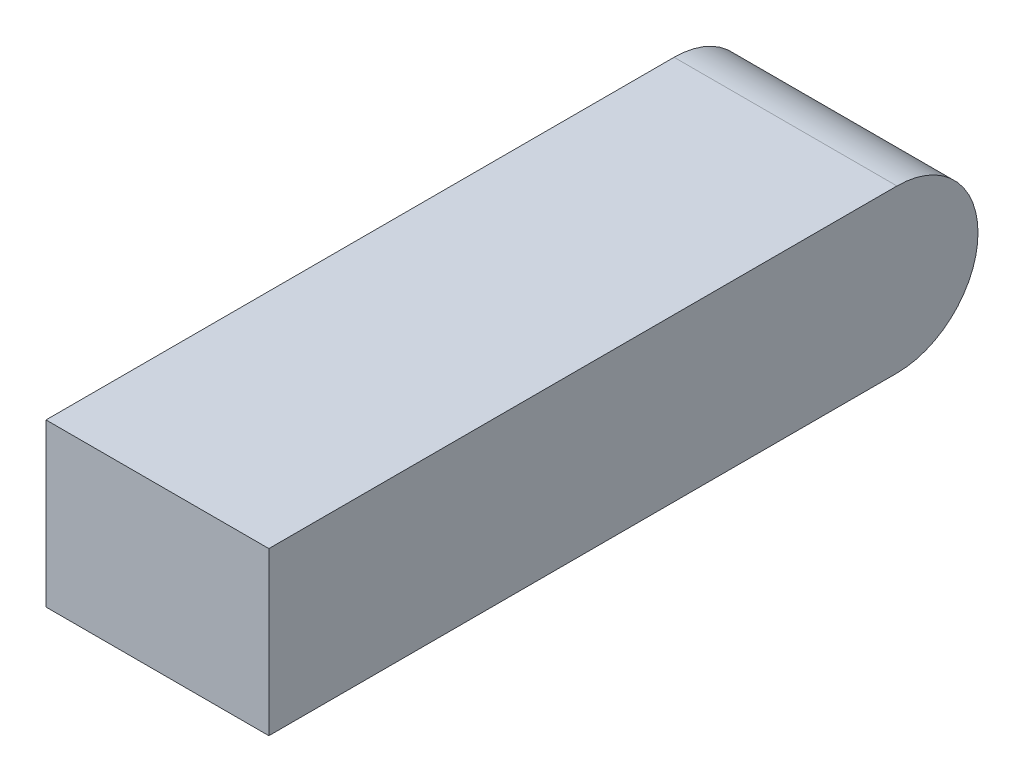
from build123d import *

# Parameters (mm, degrees)
BOSS_EXTRUDE1_DEPTH = 22


with BuildPart() as part:
    # Sketch1 → Boss-Extrude1 (new, symmetric)
    with BuildSketch(Plane(origin=(0, 0, 0), x_dir=(0, 0, -1), z_dir=(1, 0, 0))):
        with BuildLine():
            Line((-70, -16), (54, -16))
            ThreePointArc((54, -16), (70, 0), (54, 16))
            Line((54, 16), (-70, 16))
            Line((-70, 16), (-70, -16))
        make_face()
    extrude(amount=BOSS_EXTRUDE1_DEPTH, both=True)


solid = part.part
